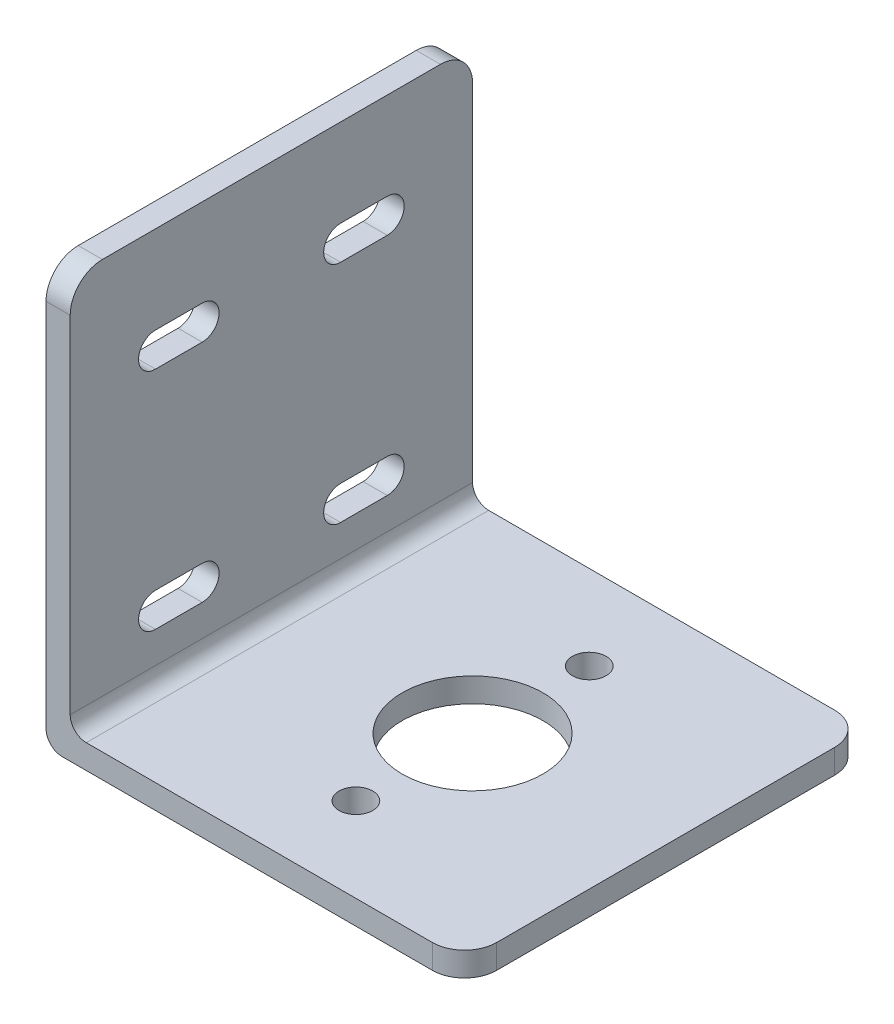
from build123d import *

# Parameters (mm, degrees)
SKETCH_1_W          = 52
SKETCH_1_H          = 50
SKETCH_1_R          = 2.1
SKETCH_1_R_2        = 8.75
EXTRUDE_1_DEPTH     = 3
SKETCH_2_W          = 3
SKETCH_2_H          = 50
EXTRUDE_2_DEPTH     = 49
CUT_EXTRUDE_1_DEPTH = 4
FILLET_1_R          = 2
FILLET_2_R          = 2
FILLET_3_R          = 4
FILLET_4_R          = 4
FILLET_5_R          = 4
FILLET_6_R          = 4


with BuildPart() as part:
    # Эскиз1 → Бобышка-Вытянуть1 (new body)
    with BuildSketch(Plane(origin=(0, 0, 0), x_dir=(1, 0, 0), z_dir=(0, 1, 0))):
        with Locations((26, 25)):
            Rectangle(SKETCH_1_W, SKETCH_1_H)
        with Locations(Location((28, 39.5, 0), (0, 0, 270))):
            Circle(SKETCH_1_R, mode=Mode.SUBTRACT)
        with Locations(Location((28, 10.5, 0), (0, 0, 270))):
            Circle(SKETCH_1_R, mode=Mode.SUBTRACT)
        with Locations(Location((28, 25, 0), (0, 0, 270))):
            Circle(SKETCH_1_R_2, mode=Mode.SUBTRACT)
    extrude(amount=EXTRUDE_1_DEPTH)

    # Эскиз2 → Бобышка-Вытянуть2 (add)
    with BuildSketch(Plane(origin=(0, 3, 0), x_dir=(1, 0, 0), z_dir=(0, 1, 0))):
        with Locations((1.5, 25)):
            Rectangle(SKETCH_2_W, SKETCH_2_H)
    extrude(amount=EXTRUDE_2_DEPTH)

    # Эскиз3 → Вырез-Вытянуть1 (cut)
    with BuildSketch(Plane.ZY):
        with BuildLine():
            Line((-39.4, 13.1), (-33.6, 13.1))
            ThreePointArc((-33.6, 13.1), (-31.5, 11), (-33.6, 8.9))
            Line((-33.6, 8.9), (-39.4, 8.9))
            ThreePointArc((-39.4, 8.9), (-41.5, 11), (-39.4, 13.1))
        make_face()
        with BuildLine():
            Line((-16.4, 13.1), (-10.6, 13.1))
            ThreePointArc((-10.6, 13.1), (-8.5, 11), (-10.6, 8.9))
            Line((-10.6, 8.9), (-16.4, 8.9))
            ThreePointArc((-16.4, 8.9), (-18.5, 11), (-16.4, 13.1))
        make_face()
        with BuildLine():
            Line((-16.4, 41.1), (-10.6, 41.1))
            ThreePointArc((-10.6, 41.1), (-8.5, 39), (-10.6, 36.9))
            Line((-10.6, 36.9), (-16.4, 36.9))
            ThreePointArc((-16.4, 36.9), (-18.5, 39), (-16.4, 41.1))
        make_face()
        with BuildLine():
            Line((-39.4, 41.1), (-33.6, 41.1))
            ThreePointArc((-33.6, 41.1), (-31.5, 39), (-33.6, 36.9))
            Line((-33.6, 36.9), (-39.4, 36.9))
            ThreePointArc((-39.4, 36.9), (-41.5, 39), (-39.4, 41.1))
        make_face()
    extrude(amount=-CUT_EXTRUDE_1_DEPTH, mode=Mode.SUBTRACT)

    # Скругление1
    fillet_1_edges = [part.edges().sort_by_distance(p)[0] for p in [
        (3, 3, -25),
    ]]
    fillet(fillet_1_edges, radius=FILLET_1_R)

    # Скругление2
    fillet_2_edges = [part.edges().sort_by_distance(p)[0] for p in [
        (0, 0, -25),
    ]]
    fillet(fillet_2_edges, radius=FILLET_2_R)

    # Скругление3
    fillet_3_edges = [part.edges().sort_by_distance(p)[0] for p in [
        (1.5, 52, 0),
    ]]
    fillet(fillet_3_edges, radius=FILLET_3_R)

    # Скругление4
    fillet_4_edges = [part.edges().sort_by_distance(p)[0] for p in [
        (1.5, 52, -50),
    ]]
    fillet(fillet_4_edges, radius=FILLET_4_R)

    # Скругление5
    fillet_5_edges = [part.edges().sort_by_distance(p)[0] for p in [
        (52, 1.5, 0),
    ]]
    fillet(fillet_5_edges, radius=FILLET_5_R)

    # Скругление6
    fillet_6_edges = [part.edges().sort_by_distance(p)[0] for p in [
        (52, 1.5, -50),
    ]]
    fillet(fillet_6_edges, radius=FILLET_6_R)


solid = part.part
